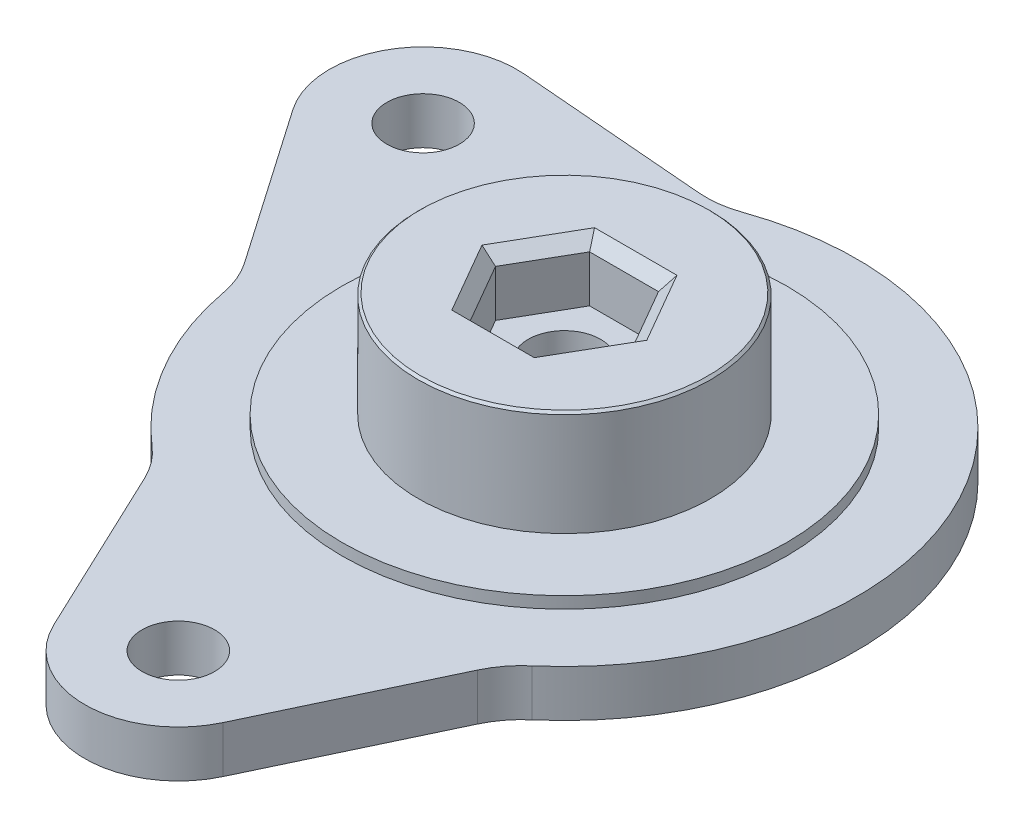
from build123d import *

# Parameters (mm, degrees)
CUT_EXTRUDE1_DEPTH  = 5
SKETCH4_R           = 3.1
CUT_EXTRUDE2_DEPTH  = 39.026306684
CHAMFER1_SIZE       = 0.2
BOSS_EXTRUDE1_START = 4
SKETCH6_R           = 3.1
BOSS_EXTRUDE1_DEPTH = 4
CIRPATTERN1_COUNT   = 2
CIRPATTERN1_ANGLE   = 120
FILLET2_R           = 8
CHAMFER2_SIZE       = 1


with BuildPart() as part:
    # Sketch2 → Revolve1 (revolve)
    with BuildSketch(Plane.XY, mode=Mode.PRIVATE) as revolve1_sk:
        Polygon((0, 0), (25, 0), (25, 4), (19, 4), (19, 5), (12.5, 5), (12.5, 14), (0, 14), align=None)
    revolve(revolve1_sk.sketch.rotate(Axis((0, 0, 0), (0, 1, 0)), 90), axis=Axis((0, 0, 0), (0, 1, 0)))

    # Sketch3 → Cut-Extrude1 (cut)
    with BuildSketch(Plane(origin=(0, 14, 0), x_dir=(1, 0, 0), z_dir=(0, 1, 0))):
        Polygon((5.888972746, 0), (2.944486373, 5.1), (-2.944486373, 5.1), (-5.888972746, 0), (-2.944486373, -5.1), (2.944486373, -5.1), align=None)
    extrude(amount=-CUT_EXTRUDE1_DEPTH, mode=Mode.SUBTRACT)

    # Sketch4 → Cut-Extrude2 (cut, through all)
    with BuildSketch(Plane(origin=(0, 0, 0), x_dir=(1, 0, 0), z_dir=(0, 1, 0))):
        with Locations(Location((0, 0, 0), (0, 0, 90))):
            Circle(SKETCH4_R)
    extrude(amount=CUT_EXTRUDE2_DEPTH, mode=Mode.SUBTRACT)

    # Chamfer1
    chamfer1_edges = [part.edges().sort_by_distance(p)[0] for p in [
        (0, 14, 12.5),
    ]]
    chamfer(chamfer1_edges, length=CHAMFER1_SIZE)

    # Sketch6 → Boss-Extrude1 (add)
    with BuildSketch(Plane(origin=(0, 0, 0), x_dir=(1, 0, 0), z_dir=(0, 1, 0)).offset(BOSS_EXTRUDE1_START)):
        with BuildLine():
            ThreePointArc((15, -20), (0, -25), (-15, -20))
            Line((-15, -20), (-7.231608683, -36.421086941))
            ThreePointArc((-7.231608683, -36.421086941), (0, -41), (7.231608683, -36.421086941))
            Line((7.231608683, -36.421086941), (15, -20))
        make_face()
        with Locations(Location((0, -33, 0), (0, 0, 270))):
            Circle(SKETCH6_R, mode=Mode.SUBTRACT)
    boss_extrude1 = extrude(amount=-BOSS_EXTRUDE1_DEPTH)

    # CirPattern1: Boss-Extrude1 ×2 about axis
    cirpattern1_axis = Axis((0, 0, 0), (0, -1, 0))
    for i in range(1, CIRPATTERN1_COUNT):
        add(boss_extrude1.rotate(cirpattern1_axis, i * CIRPATTERN1_ANGLE / (CIRPATTERN1_COUNT - 1)))

    # Fillet2
    fillet2_edges = [part.edges().sort_by_distance(p)[0] for p in [
        (-15, 2, 20),
        (15, 2, 20),
        (-9.820508076, 2, -22.990381057),
        (-24.820508076, 2, 2.990381057),
    ]]
    fillet(fillet2_edges, radius=FILLET2_R)

    # Chamfer2
    chamfer2_edges = [part.edges().sort_by_distance(p)[0] for p in [
        (4.416729559, 14, 2.55),
        (4.416729559, 14, -2.55),
        (0, 14, -5.1),
        (-4.416729559, 14, -2.55),
        (-4.416729559, 14, 2.55),
        (0, 14, 5.1),
    ]]
    chamfer(chamfer2_edges, length=CHAMFER2_SIZE)


solid = part.part
